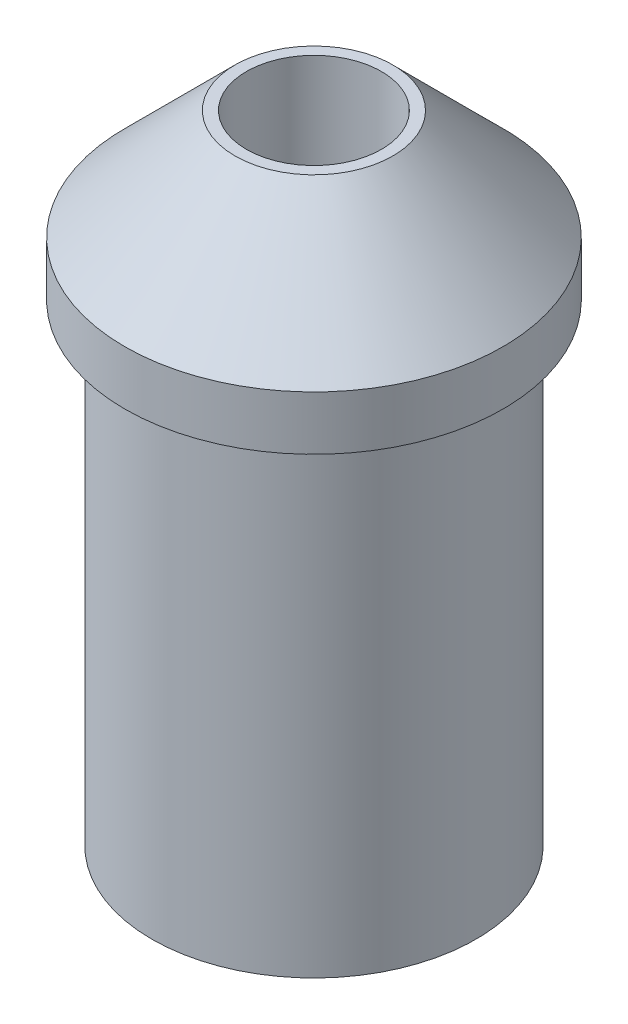
from build123d import *

# Parameters (mm, degrees)
SKETCH2_R           = 3
BOSS_EXTRUDE1_DEPTH = 8.75
SKETCH5_R           = 3.5
BOSS_EXTRUDE4_DEPTH = 1


with BuildPart() as part:
    # Sketch2 → Boss-Extrude1 (new body)
    with BuildSketch(Plane(origin=(0, 0, 0), x_dir=(1, 0, 0), z_dir=(0, 1, 0))):
        with Locations(Location((0, 0, 0), (0, 0, 270))):
            Circle(SKETCH2_R)
    extrude(amount=-BOSS_EXTRUDE1_DEPTH)

    # Sketch5 → Boss-Extrude4 (add)
    with BuildSketch(Plane(origin=(0, 0, 0), x_dir=(1, 0, 0), z_dir=(0, 1, 0))):
        with Locations(Location((0, 0, 0), (0, 0, 270))):
            Circle(SKETCH5_R)
    extrude(amount=BOSS_EXTRUDE4_DEPTH)

    # Sketch6 → Revolve1 (revolve)
    with BuildSketch(Plane.XY, mode=Mode.PRIVATE) as revolve1_sk:
        Polygon((-3.5, 1), (-1.461129737, 3.038870263), (-1.25, 3.038870263), (-1.25, 1), align=None)
    revolve(revolve1_sk.sketch.rotate(Axis((0, 3.038870263, 0), (0, -1, 0)), 270), axis=Axis((0, 3.038870263, 0), (0, -1, 0)))


solid = part.part
